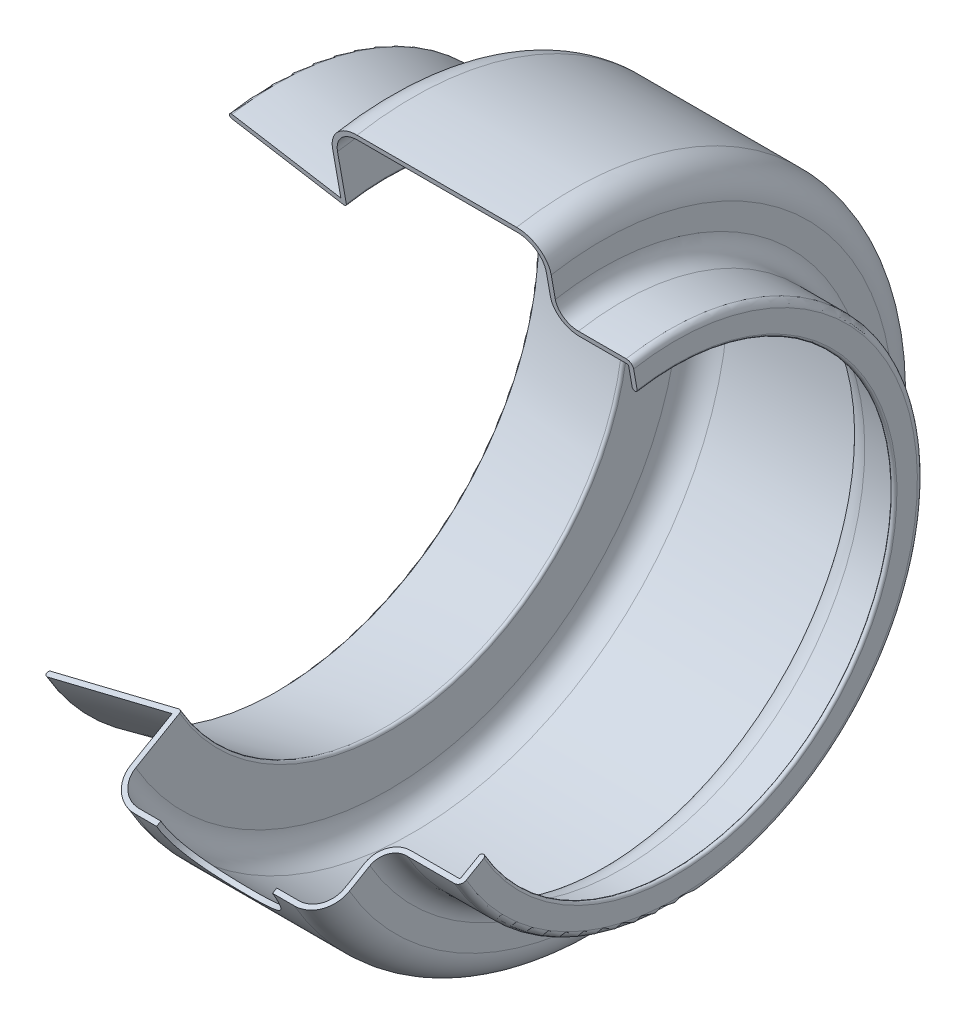
from build123d import *

# Parameters (mm, degrees)
REVOLVE1_ANGLE           = 240
REVOLVE1_OTHER_WAY_ANGLE = 10
SKETCH3_R                = 11.79
CUT_EXTRUDE1_DEPTH       = 10


with BuildPart() as part:
    # Sketch1 → Revolve1 (revolve)
    with BuildSketch(Plane.XY):
        with BuildLine():
            Line((0, 45), (0, 49.15))
            ThreePointArc((0, 49.15), (-0.380761184, 50.069238816), (-1.3, 50.45))
            Line((-1.3, 50.45), (-11, 50.45))
            ThreePointArc((-11, 50.45), (-13.828427125, 51.621572875), (-15, 54.45))
            Line((-15, 54.45), (-15, 59.25))
            ThreePointArc((-15, 59.25), (-16.757359313, 63.492640687), (-21, 65.25))
            Line((-21, 65.25), (-53.44, 65.25))
            ThreePointArc((-53.44, 65.25), (-57.682640687, 63.492640687), (-59.44, 59.25))
            Line((-59.44, 59.25), (-59.44, 49.57))
            Line((-59.44, 49.57), (-80.792962124, 54.108712211))
            ThreePointArc((-80.792962124, 54.108712211), (-81.38599177, 53.723594256), (-81.000873815, 53.13056461))
            Line((-81.000873815, 53.13056461), (-59.043955845, 48.463477621))
            ThreePointArc((-59.043955845, 48.463477621), (-58.625339804, 48.563978441), (-58.44, 48.952551422))
            Line((-58.44, 48.952551422), (-58.44, 59.25))
            ThreePointArc((-58.44, 59.25), (-56.975533906, 62.785533906), (-53.44, 64.25))
            Line((-53.44, 64.25), (-21, 64.25))
            ThreePointArc((-21, 64.25), (-17.464466094, 62.785533906), (-16, 59.25))
            Line((-16, 59.25), (-16, 54.45))
            ThreePointArc((-16, 54.45), (-14.535533906, 50.914466094), (-11, 49.45))
            Line((-11, 49.45), (-1.3, 49.45))
            ThreePointArc((-1.3, 49.45), (-1.087867966, 49.362132034), (-1, 49.15))
            Line((-1, 49.15), (-1, 45))
            ThreePointArc((-1, 45), (-0.5, 44.5), (0, 45))
        make_face()
    revolve(axis=Axis((0, 0, 0), (-1, 0, 0)), revolution_arc=REVOLVE1_ANGLE)

    # Sketch1 → Revolve1 other way (revolve)
    with BuildSketch(Plane.XY):
        with BuildLine():
            Line((0, 45), (0, 49.15))
            ThreePointArc((0, 49.15), (-0.380761184, 50.069238816), (-1.3, 50.45))
            Line((-1.3, 50.45), (-11, 50.45))
            ThreePointArc((-11, 50.45), (-13.828427125, 51.621572875), (-15, 54.45))
            Line((-15, 54.45), (-15, 59.25))
            ThreePointArc((-15, 59.25), (-16.757359313, 63.492640687), (-21, 65.25))
            Line((-21, 65.25), (-53.44, 65.25))
            ThreePointArc((-53.44, 65.25), (-57.682640687, 63.492640687), (-59.44, 59.25))
            Line((-59.44, 59.25), (-59.44, 49.57))
            Line((-59.44, 49.57), (-80.792962124, 54.108712211))
            ThreePointArc((-80.792962124, 54.108712211), (-81.38599177, 53.723594256), (-81.000873815, 53.13056461))
            Line((-81.000873815, 53.13056461), (-59.043955845, 48.463477621))
            ThreePointArc((-59.043955845, 48.463477621), (-58.625339804, 48.563978441), (-58.44, 48.952551422))
            Line((-58.44, 48.952551422), (-58.44, 59.25))
            ThreePointArc((-58.44, 59.25), (-56.975533906, 62.785533906), (-53.44, 64.25))
            Line((-53.44, 64.25), (-21, 64.25))
            ThreePointArc((-21, 64.25), (-17.464466094, 62.785533906), (-16, 59.25))
            Line((-16, 59.25), (-16, 54.45))
            ThreePointArc((-16, 54.45), (-14.535533906, 50.914466094), (-11, 49.45))
            Line((-11, 49.45), (-1.3, 49.45))
            ThreePointArc((-1.3, 49.45), (-1.087867966, 49.362132034), (-1, 49.15))
            Line((-1, 49.15), (-1, 45))
            ThreePointArc((-1, 45), (-0.5, 44.5), (0, 45))
        make_face()
    revolve(axis=Axis((0, 0, 0), (1, 0, 0)), revolution_arc=REVOLVE1_OTHER_WAY_ANGLE)

    # Sketch3 → Cut-Extrude1 (cut)
    with BuildSketch(Plane(origin=(0, -32.625, 56.508157597), x_dir=(1, 0, 0), z_dir=(0, -0.49999999999999173, 0.8660254037844436))):
        with Locations((-37.22, -0.204728204)):
            Circle(SKETCH3_R)
    extrude(amount=-CUT_EXTRUDE1_DEPTH, mode=Mode.SUBTRACT)


solid = part.part
